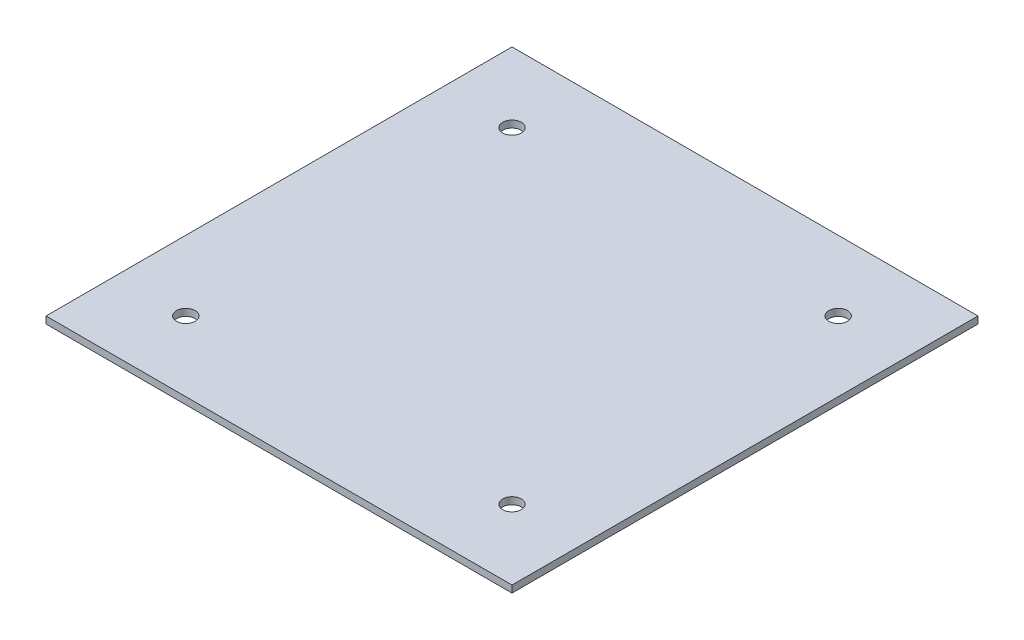
from build123d import *

# Parameters (mm, degrees)
SKICA1_W                = 200
SKICA1_H                = 200
SKICA1_R                = 4
P_IDAT_VYSUNUT_M1_DEPTH = 3


with BuildPart() as part:
    # Skica1 → Přidat vysunutím1 (new body)
    with BuildSketch(Plane(origin=(0, 0, 0), x_dir=(1, 0, 0), z_dir=(0, 1, 0))):
        with Locations((100, 100)):
            Rectangle(SKICA1_W, SKICA1_H)
        with Locations(Location((30, 170, 0), (0, 0, 270))):
            Circle(SKICA1_R, mode=Mode.SUBTRACT)
        with Locations(Location((170, 170, 0), (0, 0, 270))):
            Circle(SKICA1_R, mode=Mode.SUBTRACT)
        with Locations(Location((170, 30, 0), (0, 0, 270))):
            Circle(SKICA1_R, mode=Mode.SUBTRACT)
        with Locations(Location((30, 30, 0), (0, 0, 270))):
            Circle(SKICA1_R, mode=Mode.SUBTRACT)
    extrude(amount=P_IDAT_VYSUNUT_M1_DEPTH)


solid = part.part
